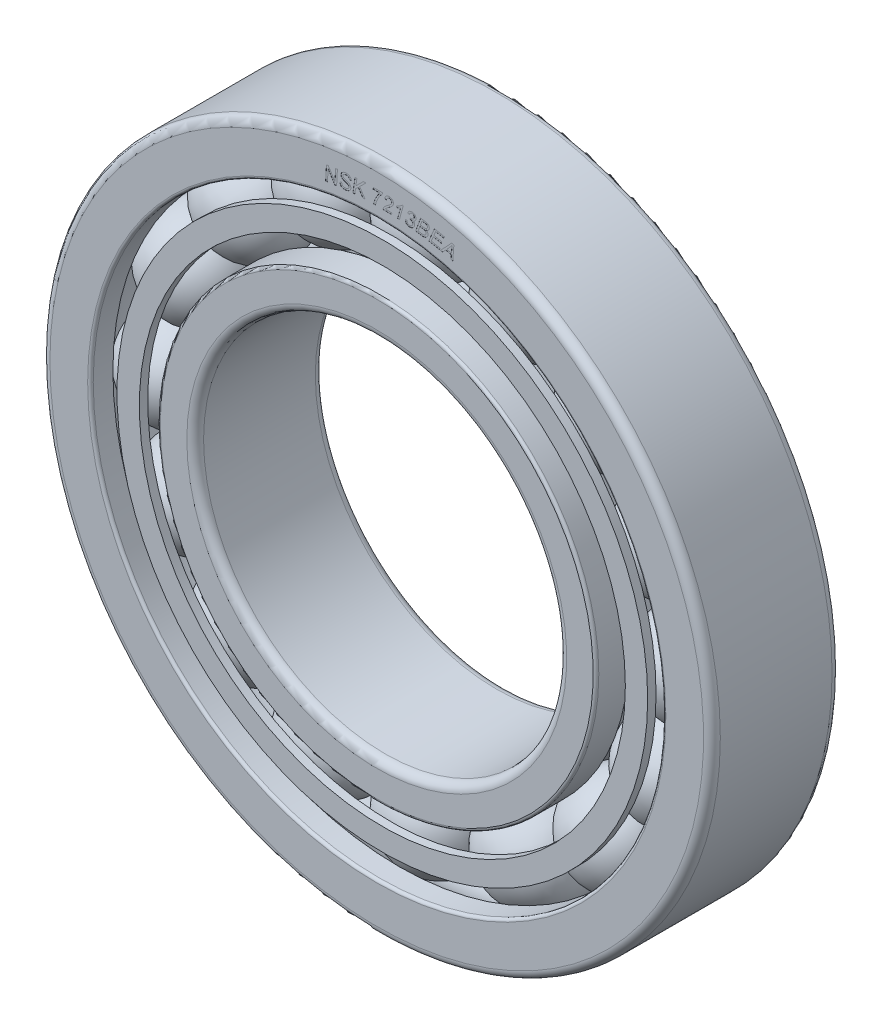
from build123d import *

# Parameters (mm, degrees)
FILLET_1_R               = 1.5
FILLET_2_R               = 1.5
FILLET_3_R               = 0.5
FILLET_4_R               = 0.5
PATTERN_CIRCULAR_1_COUNT = 16
CUT_EXTRUDE_1_DEPTH      = 0.02
SKETCH_5_R               = 47.5
SKETCH_5_R_2             = 43.5
EXTRUDE_1_DEPTH          = 1.5
SKETCH_7_R               = 50.5
SKETCH_7_R_2             = 46.5
EXTRUDE_3_DEPTH          = 1.5


with BuildPart() as part:
    # Эскиз1 → Повернуть1 (revolve)
    with BuildSketch(Plane(origin=(0, 0, 0), x_dir=(0, 0, -1), z_dir=(1, 0, 0)), mode=Mode.PRIVATE) as revolve_1_sk:
        with BuildLine():
            Line((0, 39.25), (5.843145751, 39.25))
            ThreePointArc((5.843145751, 39.25), (12.854248689, 37.352471664), (18.983314774, 41.25))
            Line((18.983314774, 41.25), (23, 41.25))
            Line((23, 41.25), (23, 32.5))
            Line((23, 32.5), (0, 32.5))
            Line((0, 32.5), (0, 39.25))
        make_face()
        with BuildLine():
            Line((0, 51.25), (4.016685226, 51.25))
            ThreePointArc((4.016685226, 51.25), (7.643281753, 54.381772523), (12.363100848, 55.208518679))
            ThreePointArc((12.363100848, 55.208518679), (17.715333377, 55.150242481), (23, 56))
            Line((23, 56), (23, 60))
            Line((23, 60), (0, 60))
            Line((0, 60), (0, 51.25))
        make_face()
    revolve(revolve_1_sk.sketch.rotate(Axis((0, 0, 0), (0, 0, -1)), 90), axis=Axis((0, 0, 0), (0, 0, -1)))

    # Скругление1
    fillet_1_edges = [part.edges().sort_by_distance(p)[0] for p in [
        (-60, 0, 0),
        (-60, 0, -23),
    ]]
    fillet(fillet_1_edges, radius=FILLET_1_R)

    # Скругление2
    fillet_2_edges = [part.edges().sort_by_distance(p)[0] for p in [
        (-32.5, 0, -23),
        (-32.5, 0, 0),
    ]]
    fillet(fillet_2_edges, radius=FILLET_2_R)

    # Скругление3
    fillet_3_edges = [part.edges().sort_by_distance(p)[0] for p in [
        (-51.25, 0, 0),
        (-56, 0, -23),
    ]]
    fillet(fillet_3_edges, radius=FILLET_3_R)

    # Скругление4
    fillet_4_edges = [part.edges().sort_by_distance(p)[0] for p in [
        (-39.25, 0, 0),
        (-41.25, 0, -23),
    ]]
    fillet(fillet_4_edges, radius=FILLET_4_R)

    # Эскиз4 → Вырез-Вытянуть1 (cut)
    # profile 1 of 10: a face of its own
    with BuildSketch(Plane.XY):
        Polygon((11.410117402, 52.014880917), (13.416101887, 54.147429184), (13.80608297, 54.052763591), (13.611606916, 51.478271063), (13.291081567, 51.556473074), (13.344588206, 52.298363207), (12.343396667, 52.542230006), (11.773345165, 51.926389167), align=None)
        with BuildLine():
            Line((12.547647973, 52.762430406), (13.366196657, 52.562809482))
            Line((13.366196657, 52.562809482), (13.421246757, 53.207976075))
            add(Edge.make_bspline(
                [(13.421246757, 53.207976075), (13.42410006, 53.23919417), (13.429683917, 53.300287365), (13.438923002, 53.389816642), (13.448805368, 53.475021092), (13.45848276, 53.556174252), (13.468686135, 53.633023962), (13.479542378, 53.705910425), (13.49080921, 53.77449605), (13.498715874, 53.81885169), (13.502535689, 53.840280495)],
                knots=[0, 0, 0, 0, 1.179734743, 2.308717599, 3.387070739, 4.407736344, 5.384398534, 6.304445204, 7.180854736, 8, 8, 8, 8], degree=3))
            add(Edge.make_bspline(
                [(13.502535689, 53.840280495), (13.477941276, 53.806800128), (13.426196333, 53.736359754), (13.338850589, 53.629630787), (13.241009589, 53.514148377), (13.169767136, 53.436336693), (13.132619597, 53.395763799)],
                knots=[0, 0, 0, 0, 0.861401509, 1.812329149, 2.859295496, 4, 4, 4, 4], degree=3))
            Line((13.132619597, 53.395763799), (12.547647973, 52.762430406))
        make_face(mode=Mode.SUBTRACT)
    # profile 2 of 10: a face of its own
    with BuildSketch(Plane.XY):
        Polygon((9.310361134, 52.426513374), (10.328016253, 54.820935482), (12.130778407, 54.464396049), (12.015018851, 54.191717983), (10.546158706, 54.482403091), (10.228720279, 53.737426036), (11.660537366, 53.453943746), (11.544263323, 53.18126568), (10.112446236, 53.464747971), (9.760022698, 52.631279167), (11.332809201, 52.320014583), (11.217049644, 52.048879978), align=None)
    # profile 3 of 10: a face of its own
    with BuildSketch(Plane.XY):
        with BuildLine():
            Line((6.964164628, 52.790516231), (7.855770454, 55.23638703))
            Line((7.855770454, 55.23638703), (8.636761592, 55.123714396))
            add(Edge.make_bspline(
                [(8.636761592, 55.123714396), (8.670065128, 55.118764215), (8.731986972, 55.109560258), (8.817552225, 55.093964672), (8.889237755, 55.079441519), (8.931624179, 55.067021392), (8.950598611, 55.061461479)],
                knots=[0, 0, 0, 0, 1.261518642, 2.34556357, 3.259385699, 4, 4, 4, 4], degree=3))
            add(Edge.make_bspline(
                [(8.950598611, 55.061461479), (8.977008574, 55.052126405), (9.028092726, 55.034069798), (9.099815546, 55.000519802), (9.163743986, 54.961755353), (9.221095654, 54.918988807), (9.271099005, 54.87088899), (9.313169104, 54.816832764), (9.347443156, 54.757069029), (9.37339691, 54.692028934), (9.392062364, 54.623334956), (9.401582773, 54.55176203), (9.403463525, 54.478016282), (9.397933322, 54.428609062), (9.395115307, 54.403432713)],
                knots=[0, 0, 0, 0, 1.1523805, 2.22902166, 3.251848478, 4.224446017, 5.167819423, 6.098219032, 7.034063993, 7.993459871, 8.972769547, 9.95596292, 10.958423637, 12, 12, 12, 12], degree=3))
            add(Edge.make_bspline(
                [(9.395115307, 54.403432713), (9.392257529, 54.386410124), (9.386616906, 54.352811283), (9.374271534, 54.303721251), (9.358170067, 54.256864096), (9.339220829, 54.211829731), (9.316484574, 54.16896736), (9.29012413, 54.128320678), (9.260691211, 54.08965193), (9.228318596, 54.05287543), (9.192065981, 54.018895603), (9.152668226, 53.98746703), (9.109388909, 53.959598407), (9.062935535, 53.93437743), (9.012977442, 53.911643468), (8.959418055, 53.892301957), (8.902577767, 53.875583234), (8.863202902, 53.867403622), (8.843070846, 53.863221451)],
                knots=[0, 0, 0, 0, 0.997521362, 1.96888742, 2.921919833, 3.85914699, 4.790430785, 5.722611136, 6.656476787, 7.597471286, 8.551225263, 9.525066915, 10.50669842, 11.522572825, 12.578482913, 13.676148185, 14.81183295, 16, 16, 16, 16], degree=3))
            add(Edge.make_bspline(
                [(8.843070846, 53.863221451), (8.858743221, 53.85494258), (8.889446908, 53.838723476), (8.933379774, 53.812822642), (8.973284485, 53.7841752), (9.009563179, 53.753911227), (9.042994198, 53.722498764), (9.072257845, 53.688938973), (9.098174657, 53.653886006), (9.127470742, 53.605241223), (9.156527311, 53.541091318), (9.177805208, 53.459383441), (9.18537746, 53.37354724), (9.179477045, 53.315949082), (9.176458367, 53.286481618)],
                knots=[0, 0, 0, 0, 0.889481206, 1.742579099, 2.556943976, 3.35142084, 4.112326028, 4.856350185, 5.582744514, 6.297109402, 7.70310764, 9.099591495, 10.516138607, 12, 12, 12, 12], degree=3))
            add(Edge.make_bspline(
                [(9.176458367, 53.286481618), (9.173688735, 53.269264072), (9.16815538, 53.234865707), (9.15417037, 53.18453984), (9.138116166, 53.134759819), (9.117061676, 53.086595715), (9.093790603, 53.038912425), (9.065403225, 52.993074631), (9.034335898, 52.947795398), (8.987628452, 52.889829346), (8.923555779, 52.822797404), (8.837333491, 52.753315183), (8.742289822, 52.697230034), (8.640297703, 52.652708608), (8.532114139, 52.621895751), (8.419598348, 52.605218098), (8.303239769, 52.600785757), (8.225286817, 52.609910899), (8.185556567, 52.614561706)],
                knots=[0, 0, 0, 0, 0.629242828, 1.257143335, 1.883821055, 2.516467848, 3.153464442, 3.798151294, 4.461254772, 5.135371534, 6.484372885, 7.801657357, 9.120760229, 10.457624248, 11.810174675, 13.169485138, 14.557372589, 16, 16, 16, 16], degree=3))
            Line((8.185556567, 52.614561706), (6.964164628, 52.790516231))
        make_face()
        with BuildLine():
            Line((7.812039066, 54.14361682), (8.32343906, 54.070045191))
            add(Edge.make_bspline(
                [(8.32343906, 54.070045191), (8.35290883, 54.06622239), (8.409849462, 54.058836085), (8.492580867, 54.051745208), (8.569541253, 54.050459764), (8.640751848, 54.052386448), (8.706073193, 54.060301199), (8.765606496, 54.071712446), (8.819127314, 54.088193638), (8.867084104, 54.109287789), (8.909446744, 54.135375622), (8.947700581, 54.164932396), (8.981133979, 54.198835292), (9.009664483, 54.237089502), (9.034229845, 54.278813094), (9.052811415, 54.325121641), (9.068325032, 54.37493431), (9.07415467, 54.410024022), (9.077162392, 54.428128085)],
                knots=[0, 0, 0, 0, 1.502219794, 2.902545341, 4.194556461, 5.391726754, 6.500401025, 7.517133001, 8.452189463, 9.325398051, 10.158027216, 10.960970728, 11.764054635, 12.556445039, 13.368324901, 14.203927591, 15.073340726, 16, 16, 16, 16], degree=3))
            add(Edge.make_bspline(
                [(9.077162392, 54.428128085), (9.078933239, 54.445421163), (9.082383467, 54.479114122), (9.080782162, 54.528974378), (9.070507367, 54.57583933), (9.054624828, 54.619648415), (9.033221067, 54.659900451), (9.005842896, 54.695425146), (8.973917651, 54.72645843), (8.942664231, 54.748481998), (8.913699128, 54.763896248), (8.886918475, 54.775422542), (8.855303178, 54.785757237), (8.818956357, 54.796207478), (8.778045589, 54.805742164), (8.732205618, 54.814977097), (8.681846908, 54.824361635), (8.646387485, 54.829393311), (8.628015315, 54.832000314)],
                knots=[0, 0, 0, 0, 1.20025396, 2.338514207, 3.428208103, 4.500047067, 5.549524654, 6.563637773, 7.585745927, 8.614491883, 9.192188196, 9.850181168, 10.625658458, 11.488103848, 12.462193969, 13.52627969, 14.718320672, 16, 16, 16, 16], degree=3))
            Line((8.628015315, 54.832000314), (8.090890974, 54.909687838))
            Line((8.090890974, 54.909687838), (7.812039066, 54.14361682))
        make_face(mode=Mode.SUBTRACT)
        with BuildLine():
            Line((7.402507481, 53.018948422), (7.977189366, 52.936116029))
            add(Edge.make_bspline(
                [(7.977189366, 52.936116029), (7.995526116, 52.93344062), (8.030618862, 52.928320442), (8.080971047, 52.922621003), (8.126487688, 52.916413149), (8.167531144, 52.912621899), (8.204029633, 52.909110083), (8.235802366, 52.908028311), (8.262893799, 52.906400713), (8.279363735, 52.907020682), (8.286910489, 52.907304761)],
                knots=[0, 0, 0, 0, 1.428150576, 2.733184842, 3.905416696, 4.968126846, 5.909946473, 6.730418274, 7.418259948, 8, 8, 8, 8], degree=3))
            add(Edge.make_bspline(
                [(8.286910489, 52.907304761), (8.313196169, 52.908501545), (8.363608084, 52.910796794), (8.435603605, 52.922359047), (8.500864143, 52.93907836), (8.55992623, 52.961767484), (8.613093712, 52.991020711), (8.661385677, 53.026250258), (8.704739152, 53.067781755), (8.743285469, 53.114551912), (8.775976491, 53.165507721), (8.801867371, 53.219630404), (8.821485219, 53.275846818), (8.828327767, 53.314823128), (8.831752134, 53.334328902)],
                knots=[0, 0, 0, 0, 1.246884701, 2.391334223, 3.450554169, 4.436701339, 5.382978919, 6.319880056, 7.263217791, 8.222199516, 9.187710378, 10.126127908, 11.062216941, 12, 12, 12, 12], degree=3))
            add(Edge.make_bspline(
                [(8.831752134, 53.334328902), (8.833598712, 53.348712184), (8.837194066, 53.37671694), (8.837410722, 53.418073352), (8.834730905, 53.457257979), (8.827267801, 53.494118301), (8.816651809, 53.528972963), (8.80143872, 53.561464992), (8.783040279, 53.592165803), (8.75970931, 53.620413254), (8.731765008, 53.64729265), (8.696392433, 53.670694785), (8.655121943, 53.692869345), (8.606968679, 53.712772509), (8.552157782, 53.730473734), (8.490962165, 53.747124604), (8.422800129, 53.760636369), (8.375086, 53.768207319), (8.35019238, 53.772157267)],
                knots=[0, 0, 0, 0, 0.928863361, 1.808529546, 2.646747168, 3.442421359, 4.214421614, 4.976968448, 5.736894975, 6.50276378, 7.319431662, 8.213005398, 9.211612466, 10.320415641, 11.547771308, 12.902653025, 14.384038861, 16, 16, 16, 16], degree=3))
            Line((8.35019238, 53.772157267), (7.710170657, 53.864764912))
            Line((7.710170657, 53.864764912), (7.402507481, 53.018948422))
        make_face(mode=Mode.SUBTRACT)
    # profile 4 of 10: a face of its own
    with BuildSketch(Plane.XY):
        with BuildLine():
            Line((5.113077534, 53.668024552), (5.419711736, 53.672140447))
            add(Edge.make_bspline(
                [(5.419711736, 53.672140447), (5.420561218, 53.650523142), (5.42220879, 53.608596298), (5.427540586, 53.547882002), (5.436860438, 53.491513821), (5.449227728, 53.439651968), (5.463750145, 53.391874776), (5.482518693, 53.348897296), (5.504110663, 53.310036384), (5.528849571, 53.275221694), (5.556918718, 53.244933186), (5.587091097, 53.217702992), (5.620099412, 53.19384601), (5.656278879, 53.17408349), (5.694732486, 53.156783268), (5.735898166, 53.142991054), (5.779809371, 53.132542547), (5.810159359, 53.128729487), (5.825641913, 53.126784316)],
                knots=[0, 0, 0, 0, 1.368518898, 2.654247442, 3.852800615, 4.979057231, 6.02557499, 7.007091832, 7.939661417, 8.833829618, 9.701543587, 10.546649616, 11.401724475, 12.271064648, 13.150098862, 14.066114148, 15.01345952, 16, 16, 16, 16], degree=3))
            add(Edge.make_bspline(
                [(5.825641913, 53.126784316), (5.844659154, 53.125014132), (5.882138905, 53.1215254), (5.938044622, 53.123233069), (5.992454053, 53.130583321), (6.045411438, 53.142794793), (6.097101627, 53.160623437), (6.147270725, 53.183669558), (6.196179522, 53.21233516), (6.242712666, 53.246096213), (6.286822329, 53.282858068), (6.325217238, 53.323484453), (6.35984671, 53.365120347), (6.38842973, 53.409514894), (6.41267932, 53.4556889), (6.430746324, 53.50421691), (6.445483098, 53.554482261), (6.450000119, 53.589215843), (6.452286977, 53.606800609)],
                knots=[0, 0, 0, 0, 1.048299956, 2.066021117, 3.063843733, 4.060064421, 5.046079128, 6.061880388, 7.08776429, 8.154315161, 9.216906954, 10.236196254, 11.220409526, 12.18711235, 13.130824451, 14.078992142, 15.027440536, 16, 16, 16, 16], degree=3))
            add(Edge.make_bspline(
                [(6.452286977, 53.606800609), (6.453611409, 53.622051038), (6.456198232, 53.651837521), (6.455022448, 53.696131515), (6.449956614, 53.738868431), (6.440765746, 53.780118998), (6.427211493, 53.819580117), (6.409586635, 53.857605297), (6.387390252, 53.893786277), (6.361781912, 53.928603426), (6.331828556, 53.96004496), (6.299421884, 53.989432564), (6.263221589, 54.014364714), (6.22426182, 54.036376931), (6.18192038, 54.054290556), (6.136514116, 54.068408636), (6.088286286, 54.080183005), (6.054817362, 54.084564377), (6.037610523, 54.086816901)],
                knots=[0, 0, 0, 0, 1.029695649, 2.011157245, 2.976189254, 3.922749042, 4.849966026, 5.7795512, 6.737723937, 7.702755946, 8.682790949, 9.655798565, 10.642135673, 11.634399209, 12.663577097, 13.729578544, 14.832744694, 16, 16, 16, 16], degree=3))
            add(Edge.make_bspline(
                [(6.037610523, 54.086816901), (6.03246479, 54.087145558), (6.020112673, 54.087934484), (5.9983677, 54.089761769), (5.970039808, 54.090444646), (5.948946, 54.091090347), (5.937285574, 54.091447284)],
                knots=[0, 0, 0, 0, 0.615994507, 1.478669069, 2.606235819, 4, 4, 4, 4], degree=3))
            Line((5.937285574, 54.091447284), (6.01960348, 54.345089333))
            add(Edge.make_bspline(
                [(6.01960348, 54.345089333), (6.033953026, 54.341376166), (6.062099719, 54.334092773), (6.090893813, 54.330078842), (6.105008309, 54.328111265)],
                knots=[0, 0, 0, 0, 1.019625648, 2, 2, 2, 2], degree=3))
            add(Edge.make_bspline(
                [(6.105008309, 54.328111265), (6.126597815, 54.326139276), (6.168687151, 54.322294828), (6.230441419, 54.320960981), (6.288759895, 54.325221136), (6.343622689, 54.333466446), (6.395398975, 54.345344215), (6.443432777, 54.363319327), (6.488559511, 54.38464421), (6.529704731, 54.411165782), (6.566977401, 54.440779512), (6.600321132, 54.472936299), (6.629346714, 54.507576705), (6.654003043, 54.544760578), (6.674867931, 54.583932957), (6.690752607, 54.625630963), (6.702985428, 54.669519175), (6.706983267, 54.700014649), (6.709015948, 54.715519913)],
                knots=[0, 0, 0, 0, 1.290371175, 2.515614044, 3.672111614, 4.76651754, 5.816401615, 6.827292839, 7.813552476, 8.782111313, 9.733954635, 10.64363931, 11.535096621, 12.418509131, 13.295290033, 14.17117896, 15.070145496, 16, 16, 16, 16], degree=3))
            add(Edge.make_bspline(
                [(6.709015948, 54.715519913), (6.710326342, 54.729738564), (6.712912615, 54.757801352), (6.711873896, 54.799568182), (6.706300275, 54.839902749), (6.698791916, 54.879171755), (6.685112519, 54.916599272), (6.669039903, 54.953228721), (6.648168582, 54.988214403), (6.624016759, 55.021571676), (6.59726993, 55.052513189), (6.567983021, 55.08027884), (6.536634089, 55.104445683), (6.503036534, 55.125220247), (6.46732346, 55.141956909), (6.43004633, 55.156398284), (6.390187305, 55.16588317), (6.362800138, 55.169851902), (6.348875107, 55.171869807)],
                knots=[0, 0, 0, 0, 1.056959341, 2.086078723, 3.0848893, 4.071348344, 5.039401223, 6.028554957, 7.030590634, 8.049390597, 9.07576304, 10.055082359, 11.033165423, 12.002550561, 12.974013698, 13.950693782, 14.958028298, 16, 16, 16, 16], degree=3))
            add(Edge.make_bspline(
                [(6.348875107, 55.171869807), (6.335166261, 55.172966966), (6.307770993, 55.175159489), (6.26673343, 55.174147234), (6.226450851, 55.168877688), (6.186805109, 55.160062524), (6.147781765, 55.147304216), (6.109585298, 55.129966183), (6.07175743, 55.10939378), (6.035000924, 55.084680216), (5.999407059, 55.056792176), (5.967122804, 55.024310679), (5.936373811, 54.989551896), (5.90912286, 54.950283578), (5.883888258, 54.907945555), (5.862103855, 54.861688837), (5.841372397, 54.81272273), (5.830975212, 54.778060483), (5.825641913, 54.760280275)],
                knots=[0, 0, 0, 0, 0.908235866, 1.814986241, 2.706025465, 3.588449818, 4.494987781, 5.413065499, 6.356251536, 7.336745671, 8.336559827, 9.338106043, 10.358196282, 11.398784442, 12.490903383, 13.610881053, 14.77448709, 16, 16, 16, 16], degree=3))
            Line((5.825641913, 54.760280275), (5.526725015, 54.857003815))
            add(Edge.make_bspline(
                [(5.526725015, 54.857003815), (5.536335472, 54.881500066), (5.555220895, 54.929637432), (5.588773991, 54.99808116), (5.625913088, 55.061823801), (5.666995035, 55.120703864), (5.712604466, 55.174298417), (5.76142845, 55.223414559), (5.814340071, 55.267462069), (5.870882348, 55.306425668), (5.930190727, 55.340353513), (5.992005065, 55.36817559), (6.055254306, 55.390954055), (6.120501673, 55.408012207), (6.187650465, 55.419401112), (6.256833221, 55.424711995), (6.327918503, 55.425801287), (6.375650702, 55.421168374), (6.399809311, 55.418823527)],
                knots=[0, 0, 0, 0, 1.120118601, 2.201135125, 3.241914166, 4.258929712, 5.253786321, 6.234879163, 7.204462945, 8.180815521, 9.155418752, 10.109701985, 11.063649871, 12.014798608, 12.977621396, 13.959447744, 14.967219058, 16, 16, 16, 16], degree=3))
            add(Edge.make_bspline(
                [(6.399809311, 55.418823527), (6.424928285, 55.415507379), (6.474186738, 55.409004394), (6.545212009, 55.391703235), (6.612149692, 55.36971612), (6.674750452, 55.341825046), (6.732964461, 55.308306209), (6.786996379, 55.26961151), (6.835991653, 55.224917176), (6.880505746, 55.175733644), (6.920108069, 55.122945456), (6.953590863, 55.067452782), (6.98057461, 55.009827745), (7.001386029, 54.950201331), (7.015648476, 54.888428774), (7.024044895, 54.824691898), (7.025604694, 54.758973014), (7.021733606, 54.714813161), (7.019766045, 54.692368002)],
                knots=[0, 0, 0, 0, 1.136359437, 2.228407424, 3.274947664, 4.294742082, 5.29805241, 6.284903422, 7.271154013, 8.26827567, 9.258033554, 10.228176563, 11.171574053, 12.108671656, 13.057047696, 14.01168022, 14.98939534, 16, 16, 16, 16], degree=3))
            add(Edge.make_bspline(
                [(7.019766045, 54.692368002), (7.015143834, 54.660236501), (7.006103387, 54.597391433), (6.975196794, 54.50859947), (6.933485937, 54.426951546), (6.878146014, 54.353867114), (6.810556646, 54.288833512), (6.731133711, 54.231472549), (6.639032215, 54.182343478), (6.571975958, 54.157050607), (6.537177318, 54.143924949)],
                knots=[0, 0, 0, 0, 1.002220091, 1.960213137, 2.892776631, 3.828654363, 4.781654184, 5.784505993, 6.850276135, 8, 8, 8, 8], degree=3))
            add(Edge.make_bspline(
                [(6.537177318, 54.143924949), (6.559081325, 54.126616117), (6.601757917, 54.092892516), (6.656333103, 54.034863553), (6.701339248, 53.973633933), (6.736294044, 53.908716068), (6.760959927, 53.840165697), (6.776846595, 53.768276642), (6.781842483, 53.692686166), (6.777906116, 53.641594729), (6.775899247, 53.615546886)],
                knots=[0, 0, 0, 0, 1.097875357, 2.139041469, 3.124884337, 4.08243844, 5.03076001, 5.984258987, 6.972318896, 8, 8, 8, 8], degree=3))
            add(Edge.make_bspline(
                [(6.775899247, 53.615546886), (6.772029058, 53.587823102), (6.764376996, 53.53300817), (6.742777918, 53.453637503), (6.714507404, 53.377851564), (6.678156831, 53.305706867), (6.633797709, 53.237398156), (6.582082302, 53.172781237), (6.522711085, 53.112073133), (6.456690386, 53.055870237), (6.385881785, 53.005230755), (6.311794442, 52.962186139), (6.235672765, 52.927140767), (6.157164663, 52.899926155), (6.076400057, 52.881507076), (5.993332822, 52.871383442), (5.908191105, 52.868334002), (5.851001445, 52.873233558), (5.822040505, 52.875714701)],
                knots=[0, 0, 0, 0, 1.002765114, 1.982647835, 2.941942652, 3.898869908, 4.872715141, 5.856986452, 6.861409093, 7.912476156, 8.961761214, 9.978399029, 10.979862573, 11.961826545, 12.952224482, 13.943671621, 14.958671857, 16, 16, 16, 16], degree=3))
            add(Edge.make_bspline(
                [(5.822040505, 52.875714701), (5.794180231, 52.879367925), (5.739785016, 52.886500586), (5.661145668, 52.904761008), (5.587369138, 52.928463106), (5.517999223, 52.957210014), (5.453430541, 52.991670285), (5.393827407, 53.032106359), (5.339178302, 53.078137779), (5.289225649, 53.128993797), (5.244892501, 53.184403106), (5.207458913, 53.244092761), (5.175124009, 53.306329185), (5.149963562, 53.372325298), (5.130636472, 53.441524618), (5.118878564, 53.514345175), (5.111545308, 53.59019049), (5.112560682, 53.641769478), (5.113077534, 53.668024552)],
                knots=[0, 0, 0, 0, 1.138289366, 2.222429499, 3.26652677, 4.275970636, 5.26173364, 6.227569183, 7.189595697, 8.152952069, 9.112539919, 10.059304643, 11.004307278, 11.950459474, 12.916695094, 13.910827577, 14.936555761, 16, 16, 16, 16], degree=3))
        make_face()
    # profile 5 of 10: a face of its own
    with BuildSketch(Plane.XY):
        with BuildLine():
            Line((3.7334604, 53.116639928), (4.260809489, 55.0130387))
            add(Edge.make_bspline(
                [(4.260809489, 55.0130387), (4.237211218, 54.997378405), (4.188920008, 54.965331369), (4.109962257, 54.923687975), (4.025354691, 54.884095639), (3.934097534, 54.84751727), (3.836677698, 54.813535795), (3.732263773, 54.783548374), (3.621838812, 54.755507105), (3.545573522, 54.740039125), (3.50657167, 54.732128844)],
                knots=[0, 0, 0, 0, 0.838411649, 1.715715178, 2.640638597, 3.60467088, 4.626384728, 5.695356246, 6.821411767, 8, 8, 8, 8], degree=3))
            Line((3.50657167, 54.732128844), (3.583744708, 55.0130387))
            add(Edge.make_bspline(
                [(3.583744708, 55.0130387), (3.624023048, 55.02704425), (3.705189595, 55.055267412), (3.825355741, 55.105383309), (3.944685734, 55.163441773), (4.061579434, 55.226275527), (4.170583155, 55.291464548), (4.268144203, 55.353494645), (4.351403095, 55.41145576), (4.399941657, 55.451437967), (4.422358381, 55.469903082)],
                knots=[0, 0, 0, 0, 1.066132409, 2.148407456, 3.253132279, 4.383208523, 5.465755388, 6.428090278, 7.274039752, 8, 8, 8, 8], degree=3))
            add(Edge.make_bspline(
                [(4.422358381, 55.469903082), (4.447408546, 55.493457196), (4.499711271, 55.542636286), (4.542888213, 55.600012428), (4.565385744, 55.629908513)],
                knots=[0, 0, 0, 0, 0.957891411, 2, 2, 2, 2], degree=3))
            Line((4.565385744, 55.629908513), (4.747514112, 55.618075314))
            Line((4.747514112, 55.618075314), (4.049355367, 53.096574938))
            Line((4.049355367, 53.096574938), (3.7334604, 53.116639928))
        make_face()
    # profile 6 of 10: a face of its own
    with BuildSketch(Plane.XY):
        with BuildLine():
            add(Edge.make_bspline(
                [(1.110849669, 53.233605524), (1.120863094, 53.269754246), (1.140218746, 53.33962865), (1.175537123, 53.438686257), (1.215856077, 53.527933683), (1.260012232, 53.609508325), (1.31098104, 53.684439106), (1.367916755, 53.756129875), (1.431190031, 53.825925208), (1.49108972, 53.881926662), (1.545317819, 53.929574697), (1.59548954, 53.970401118), (1.653487355, 54.017442696), (1.720632426, 54.069258831), (1.796175526, 54.126770477), (1.880078689, 54.189998481), (1.972073655, 54.259134194), (2.036698061, 54.306387078), (2.070367768, 54.331006116)],
                knots=[0, 0, 0, 0, 1.202700078, 2.324783473, 3.36848823, 4.340727197, 5.295622279, 6.270517662, 7.274952979, 8.313660986, 8.898299247, 9.589812029, 10.387759059, 11.293159435, 12.309554252, 13.432621145, 14.662380076, 16, 16, 16, 16], degree=3))
            add(Edge.make_bspline(
                [(2.070367768, 54.331006116), (2.090822655, 54.345862665), (2.130204553, 54.374466055), (2.186153914, 54.416665802), (2.23716017, 54.455898472), (2.283436509, 54.491731722), (2.324623332, 54.524635974), (2.360657028, 54.55446209), (2.391846195, 54.581243522), (2.410495046, 54.598653749), (2.419189897, 54.606771103)],
                knots=[0, 0, 0, 0, 1.363740725, 2.625617026, 3.780249737, 4.835058242, 5.78285203, 6.623854171, 7.358385035, 8, 8, 8, 8], degree=3))
            add(Edge.make_bspline(
                [(2.419189897, 54.606771103), (2.440560379, 54.628115652), (2.481900705, 54.669405812), (2.537296721, 54.733518921), (2.58324669, 54.798216218), (2.607880201, 54.842856263), (2.619839794, 54.864529048)],
                knots=[0, 0, 0, 0, 1.104403278, 2.136423082, 3.0952316, 4, 4, 4, 4], degree=3))
            add(Edge.make_bspline(
                [(2.619839794, 54.864529048), (2.626535302, 54.879142788), (2.640039936, 54.908618255), (2.654006958, 54.9557071), (2.664279942, 55.004747522), (2.66654166, 55.03837401), (2.667687077, 55.055403694)],
                knots=[0, 0, 0, 0, 0.972384877, 1.961270675, 2.967512838, 4, 4, 4, 4], degree=3))
            add(Edge.make_bspline(
                [(2.667687077, 55.055403694), (2.667983583, 55.069816462), (2.668567395, 55.098194876), (2.664323528, 55.140112323), (2.655975515, 55.180375055), (2.644223758, 55.219254952), (2.628189688, 55.25654738), (2.607724661, 55.292100526), (2.584347312, 55.326793358), (2.556267758, 55.358929667), (2.526062422, 55.388981092), (2.493270738, 55.415460123), (2.458787617, 55.438333928), (2.421901362, 55.456854006), (2.383278926, 55.471772976), (2.342805724, 55.483105243), (2.300464166, 55.49113177), (2.271396399, 55.492864997), (2.256612031, 55.493746546)],
                knots=[0, 0, 0, 0, 1.032712451, 2.033387493, 3.01230198, 3.976750105, 4.940492736, 5.914919251, 6.914082699, 7.934204665, 8.968744991, 9.965257631, 10.950712394, 11.92939525, 12.917989265, 13.914350217, 14.939202523, 16, 16, 16, 16], degree=3))
            add(Edge.make_bspline(
                [(2.256612031, 55.493746546), (2.241852641, 55.4940622), (2.212782709, 55.494683908), (2.169761354, 55.490147891), (2.127978778, 55.482756298), (2.087392371, 55.470547624), (2.047912694, 55.454937298), (2.010142119, 55.434355011), (1.973348075, 55.410653996), (1.937899013, 55.382923061), (1.90402658, 55.3507692), (1.872773028, 55.313468813), (1.843428486, 55.271598024), (1.81610177, 55.225220723), (1.791420745, 55.173843134), (1.768981477, 55.117741267), (1.748214258, 55.05680946), (1.736733398, 55.014146541), (1.730806403, 54.992121803)],
                knots=[0, 0, 0, 0, 0.891257531, 1.755410997, 2.609123593, 3.451883803, 4.312113384, 5.169842291, 6.046581179, 6.954611879, 7.88553672, 8.863498142, 9.889951607, 10.972375156, 12.112591228, 13.33077172, 14.622010552, 16, 16, 16, 16], degree=3))
            Line((1.730806403, 54.992121803), (1.425201175, 55.050773312))
            add(Edge.make_bspline(
                [(1.425201175, 55.050773312), (1.430606743, 55.078141001), (1.441209282, 55.131820282), (1.464018264, 55.209061132), (1.491807416, 55.281802525), (1.52530616, 55.349497898), (1.563400719, 55.413020446), (1.607467874, 55.47106367), (1.655978088, 55.525172023), (1.709897923, 55.573810085), (1.768153204, 55.616887867), (1.829323239, 55.654832127), (1.894123948, 55.685703042), (1.961811994, 55.710540584), (2.032471338, 55.728953073), (2.106118625, 55.741521318), (2.182957689, 55.746990596), (2.235170632, 55.746231605), (2.261756901, 55.745845135)],
                knots=[0, 0, 0, 0, 1.116229553, 2.189384642, 3.219517052, 4.229621657, 5.209193556, 6.179920926, 7.142310277, 8.114396123, 9.081012233, 10.039426678, 10.991303179, 11.949102743, 12.921552144, 13.91022317, 14.93590812, 16, 16, 16, 16], degree=3))
            add(Edge.make_bspline(
                [(2.261756901, 55.745845135), (2.297188913, 55.743240132), (2.366566374, 55.738139419), (2.467470235, 55.71654946), (2.562649088, 55.684081912), (2.651504609, 55.640959827), (2.732439659, 55.588650868), (2.802248619, 55.525927063), (2.861367841, 55.455034618), (2.906903153, 55.375370856), (2.942206758, 55.292164044), (2.966805558, 55.206867469), (2.98015758, 55.120495257), (2.980039522, 55.062648702), (2.979980635, 55.033795244)],
                knots=[0, 0, 0, 0, 1.128828806, 2.210297158, 3.271047296, 4.319952983, 5.344076798, 6.325149161, 7.293740772, 8.266591968, 9.231984258, 10.162465089, 11.083450395, 12, 12, 12, 12], degree=3))
            add(Edge.make_bspline(
                [(2.979980635, 55.033795244), (2.978428487, 55.012838638), (2.975320211, 54.970871726), (2.964600523, 54.908395265), (2.947090285, 54.846998347), (2.925309468, 54.785951836), (2.896543208, 54.726375593), (2.863086201, 54.667433491), (2.823775685, 54.609510602), (2.794006677, 54.572608981), (2.778816251, 54.553778951)],
                knots=[0, 0, 0, 0, 0.951069821, 1.904576784, 2.863379649, 3.838485029, 4.835234883, 5.854116166, 6.905005866, 8, 8, 8, 8], degree=3))
            add(Edge.make_bspline(
                [(2.778816251, 54.553778951), (2.773338122, 54.54759795), (2.761502099, 54.534243304), (2.742206694, 54.51288159), (2.718065865, 54.490705452), (2.691747622, 54.46537681), (2.661399071, 54.43844211), (2.62783238, 54.409399164), (2.590568033, 54.37840622), (2.549767206, 54.345497058), (2.505698577, 54.310162482), (2.458486816, 54.272397797), (2.407164011, 54.233452155), (2.353070101, 54.191765906), (2.294993064, 54.148580166), (2.234137965, 54.102635586), (2.16894952, 54.055450493), (2.124547893, 54.023016793), (2.10175147, 54.006364872)],
                knots=[0, 0, 0, 0, 0.454717768, 0.982461328, 1.583403455, 2.257924967, 2.993320043, 3.816599997, 4.701397922, 5.661229844, 6.702134953, 7.810868785, 8.989125278, 10.248547441, 11.570226374, 12.973095425, 14.445944406, 16, 16, 16, 16], degree=3))
            add(Edge.make_bspline(
                [(2.10175147, 54.006364872), (2.082361199, 53.992146607), (2.044687921, 53.964521998), (1.989940024, 53.92397862), (1.939472317, 53.884836595), (1.891993865, 53.848604301), (1.849797383, 53.812571367), (1.809814179, 53.780141237), (1.774480767, 53.748701638), (1.733210788, 53.710216655), (1.687608867, 53.664131258), (1.638635392, 53.609849921), (1.596813837, 53.556951009), (1.573615141, 53.520535673), (1.562569182, 53.503196668)],
                knots=[0, 0, 0, 0, 1.166534815, 2.266455786, 3.304868386, 4.265181266, 5.16321159, 5.996259981, 6.762521778, 7.457137211, 8.733803487, 9.906345992, 11.003115682, 12, 12, 12, 12], degree=3))
            Line((1.562569182, 53.503196668), (2.701643214, 53.455349385))
            Line((2.701643214, 53.455349385), (2.628586072, 53.169809147))
            Line((2.628586072, 53.169809147), (1.110849669, 53.233605524))
        make_face()
    # profile 7 of 10: a face of its own
    with BuildSketch(Plane.XY):
        with BuildLine():
            add(Edge.make_bspline(
                [(-0.558029174, 53.241749748), (-0.554412724, 53.263729747), (-0.546957167, 53.309043011), (-0.532387476, 53.378341321), (-0.514811488, 53.451066302), (-0.494206795, 53.526839564), (-0.470961759, 53.605941713), (-0.444768675, 53.688127234), (-0.415246044, 53.773593849), (-0.394321124, 53.831548447), (-0.38361811, 53.861191995)],
                knots=[0, 0, 0, 0, 0.829353319, 1.709768305, 2.635957467, 3.614948424, 4.633340765, 5.70569938, 6.826474284, 8, 8, 8, 8], degree=3))
            add(Edge.make_bspline(
                [(-0.38361811, 53.861191995), (-0.355735272, 53.934216909), (-0.299510155, 54.081470009), (-0.200344878, 54.298805406), (-0.089191928, 54.515416938), (0.013112994, 54.693786415), (0.099977808, 54.834345952), (0.168257437, 54.936382984), (0.237915867, 55.034982863), (0.309499205, 55.129665897), (0.382627806, 55.220701691), (0.458377855, 55.307332994), (0.535368062, 55.390934648), (0.58857748, 55.444103632), (0.615000994, 55.470507068)],
                knots=[0, 0, 0, 0, 1.473953433, 2.972193993, 4.502669018, 6.064485725, 6.848934555, 7.618627882, 8.379655031, 9.125526554, 9.856972894, 10.581449156, 11.295555173, 12, 12, 12, 12], degree=3))
            Line((0.615000994, 55.470507068), (-0.654238228, 55.463818738))
            Line((-0.654238228, 55.463818738), (-0.595072232, 55.752445898))
            Line((-0.595072232, 55.752445898), (1.030191936, 55.760677689))
            Line((1.030191936, 55.760677689), (0.972569401, 55.472565016))
            add(Edge.make_bspline(
                [(0.972569401, 55.472565016), (0.938448329, 55.441359719), (0.869774333, 55.378554177), (0.77204075, 55.277079711), (0.677287169, 55.169442155), (0.585611928, 55.055226255), (0.497849368, 54.934038391), (0.412740191, 54.806902493), (0.331299745, 54.672946168), (0.280565413, 54.580135654), (0.254860153, 54.533111907)],
                knots=[0, 0, 0, 0, 0.933587849, 1.878991596, 2.84336905, 3.828852324, 4.835398066, 5.864149695, 6.917841515, 8, 8, 8, 8], degree=3))
            add(Edge.make_bspline(
                [(0.254860153, 54.533111907), (0.226016032, 54.478252407), (0.168967888, 54.369750827), (0.090868576, 54.20544631), (0.019989037, 54.042305817), (-0.044811805, 53.880559903), (-0.101632851, 53.719807889), (-0.15192587, 53.560317023), (-0.194742031, 53.402025646), (-0.218179919, 53.296208881), (-0.229786522, 53.243807696)],
                knots=[0, 0, 0, 0, 1.076210614, 2.128538385, 3.158152719, 4.164629244, 5.153634817, 6.118124782, 7.068082514, 8, 8, 8, 8], degree=3))
            Line((-0.229786522, 53.243807696), (-0.558029174, 53.241749748))
        make_face()
    # profile 8 of 10: a face of its own
    with BuildSketch(Plane.XY):
        Polygon((-4.268311776, 53.075496098), (-3.896852222, 55.654619008), (-3.556776371, 55.676227459), (-3.734788844, 54.434256043), (-2.429535538, 55.747226653), (-1.950548219, 55.777066894), (-3.068013801, 54.666289642), (-2.106437755, 53.211835131), (-2.486643586, 53.187654246), (-3.302619834, 54.431683609), (-3.806302525, 53.934689248), (-3.927721437, 53.097104548), align=None)
    # profile 9 of 10: a face of its own
    with BuildSketch(Plane.XY):
        with BuildLine():
            Line((-6.609009989, 53.661206565), (-6.278194902, 53.722430508))
            Line((-6.278194902, 53.722430508), (-6.274079007, 53.633424272))
            add(Edge.make_bspline(
                [(-6.274079007, 53.633424272), (-6.271109879, 53.609465897), (-6.265245331, 53.562143913), (-6.245512953, 53.493846182), (-6.218945965, 53.428900812), (-6.183442989, 53.36838739), (-6.138416799, 53.313455443), (-6.082241471, 53.266753217), (-6.016045327, 53.227895008), (-5.939888898, 53.198045473), (-5.85562356, 53.176041986), (-5.763956814, 53.163498905), (-5.665713689, 53.159928387), (-5.598368168, 53.164448975), (-5.563572576, 53.166784639)],
                knots=[0, 0, 0, 0, 0.900836824, 1.779310477, 2.646871574, 3.517291588, 4.391101762, 5.287070707, 6.232219634, 7.247254626, 8.333709868, 9.479205135, 10.697574099, 12, 12, 12, 12], degree=3))
            add(Edge.make_bspline(
                [(-5.563572576, 53.166784639), (-5.538838405, 53.169400746), (-5.490882721, 53.174472966), (-5.421555238, 53.186797966), (-5.357263583, 53.203212062), (-5.29783403, 53.223148725), (-5.243445349, 53.24693783), (-5.193614575, 53.274158575), (-5.148754569, 53.305562125), (-5.109021497, 53.340573412), (-5.074989689, 53.378284091), (-5.044825272, 53.416054889), (-5.020106487, 53.455144355), (-5.001489874, 53.495288225), (-4.986280648, 53.535692448), (-4.97805106, 53.577182598), (-4.973197411, 53.619282703), (-4.975078486, 53.647480052), (-4.976028518, 53.661721052)],
                knots=[0, 0, 0, 0, 1.395969759, 2.706566712, 3.948796917, 5.117879318, 6.221506061, 7.27723044, 8.300181788, 9.289181072, 10.243117695, 11.148296008, 12.000414111, 12.831552934, 13.629406428, 14.416794091, 15.200405859, 16, 16, 16, 16], degree=3))
            add(Edge.make_bspline(
                [(-4.976028518, 53.661721052), (-4.978918634, 53.681269257), (-4.984657661, 53.720086957), (-5.006022052, 53.775661052), (-5.037783485, 53.827521231), (-5.065993026, 53.857352253), (-5.080469362, 53.872660688)],
                knots=[0, 0, 0, 0, 0.98425914, 1.954485125, 2.95029978, 4, 4, 4, 4], degree=3))
            add(Edge.make_bspline(
                [(-5.080469362, 53.872660688), (-5.089904341, 53.880607093), (-5.110852517, 53.898250238), (-5.149816296, 53.921941805), (-5.197659876, 53.947451248), (-5.254919831, 53.974783477), (-5.322063799, 54.002753433), (-5.398658384, 54.032672319), (-5.485117917, 54.063242482), (-5.546049983, 54.083690071), (-5.577978209, 54.094404549)],
                knots=[0, 0, 0, 0, 0.540193669, 1.199374389, 1.993337854, 2.918253284, 3.979659742, 5.18193929, 6.52334436, 8, 8, 8, 8], degree=3))
            add(Edge.make_bspline(
                [(-5.577978209, 54.094404549), (-5.603021617, 54.102791822), (-5.651103774, 54.118894988), (-5.720042948, 54.142264382), (-5.782473256, 54.165210673), (-5.838942279, 54.186178398), (-5.889517677, 54.20553843), (-5.933667222, 54.2241525), (-5.971848859, 54.240929628), (-5.994917333, 54.252281118), (-6.005516837, 54.257496901)],
                knots=[0, 0, 0, 0, 1.384197928, 2.657594401, 3.814828672, 4.869965264, 5.814700581, 6.652670015, 7.380928718, 8, 8, 8, 8], degree=3))
            add(Edge.make_bspline(
                [(-6.005516837, 54.257496901), (-6.034329783, 54.273749858), (-6.089901357, 54.305096961), (-6.164676486, 54.35934438), (-6.228986829, 54.416676949), (-6.282359512, 54.478350117), (-6.32460656, 54.545466048), (-6.357286545, 54.617351153), (-6.379890893, 54.695026962), (-6.386476194, 54.749037252), (-6.389838563, 54.776614199)],
                knots=[0, 0, 0, 0, 1.172594345, 2.261584516, 3.26940021, 4.222785237, 5.144197471, 6.072511015, 7.01584935, 8, 8, 8, 8], degree=3))
            add(Edge.make_bspline(
                [(-6.389838563, 54.776614199), (-6.391300956, 54.808699754), (-6.394182264, 54.871916903), (-6.382031395, 54.965801162), (-6.355254309, 55.05564942), (-6.322197092, 55.127065823), (-6.289176264, 55.181306515), (-6.260371383, 55.220017044), (-6.229340897, 55.257564993), (-6.193247046, 55.291465784), (-6.155494841, 55.325007105), (-6.113271501, 55.354960746), (-6.068712699, 55.384216712), (-6.003302456, 55.418969657), (-5.916229843, 55.458326752), (-5.803821191, 55.493619701), (-5.684505048, 55.521264499), (-5.60178167, 55.530329733), (-5.55945668, 55.534967913)],
                knots=[0, 0, 0, 0, 1.22055395, 2.404818596, 3.581886521, 4.77610736, 5.388352723, 5.995323172, 6.611175313, 7.238843851, 7.877343758, 8.531331491, 9.206563201, 9.904499128, 11.347716291, 12.835758416, 14.381032093, 16, 16, 16, 16], degree=3))
            add(Edge.make_bspline(
                [(-5.55945668, 55.534967913), (-5.534088813, 55.536933769), (-5.484260479, 55.540795161), (-5.410592147, 55.542206112), (-5.339659654, 55.540347647), (-5.271524418, 55.534458746), (-5.205953722, 55.526161681), (-5.143343709, 55.51301746), (-5.083282479, 55.497231595), (-5.026239002, 55.47768748), (-4.972456886, 55.454963117), (-4.921503766, 55.430373547), (-4.874485644, 55.402669943), (-4.830788372, 55.372601604), (-4.790578832, 55.340060584), (-4.753376797, 55.305326971), (-4.720304223, 55.267314104), (-4.681519278, 55.214788281), (-4.640478418, 55.147658988), (-4.602791359, 55.065956457), (-4.575454917, 54.985312231), (-4.568396568, 54.93079884), (-4.564953472, 54.904206954)],
                knots=[0, 0, 0, 0, 1.160068754, 2.278642183, 3.35832045, 4.394200807, 5.396259216, 6.370182636, 7.309192946, 8.226724522, 9.117056899, 9.970456282, 10.804721317, 11.603022496, 12.387139285, 13.161642349, 13.920872752, 14.681028972, 16.137611383, 17.498755323, 18.779881198, 20, 20, 20, 20], degree=3))
            add(Edge.make_bspline(
                [(-4.564953472, 54.904206954), (-4.564381666, 54.897350217), (-4.562939831, 54.880060636), (-4.562591329, 54.862712158), (-4.562381037, 54.852243776)],
                knots=[0, 0, 0, 0, 0.793164161, 2, 2, 2, 2], degree=3))
            Line((-4.562381037, 54.852243776), (-4.888565742, 54.796679189))
            add(Edge.make_bspline(
                [(-4.888565742, 54.796679189), (-4.890305407, 54.813673877), (-4.893584064, 54.845702902), (-4.900422719, 54.890682094), (-4.910015562, 54.929428067), (-4.918563461, 54.952628937), (-4.922521878, 54.96337295)],
                knots=[0, 0, 0, 0, 1.200731465, 2.262957667, 3.195598952, 4, 4, 4, 4], degree=3))
            add(Edge.make_bspline(
                [(-4.922521878, 54.96337295), (-4.930257759, 54.979829591), (-4.945505934, 55.012267234), (-4.97371382, 55.05750737), (-5.007785085, 55.097181563), (-5.045605647, 55.13326085), (-5.089019498, 55.165134939), (-5.138802872, 55.192466741), (-5.195435681, 55.214852274), (-5.257750731, 55.233193112), (-5.325078321, 55.246448162), (-5.396155872, 55.254145), (-5.470523387, 55.255669339), (-5.520884778, 55.25221838), (-5.546594508, 55.250456649)],
                knots=[0, 0, 0, 0, 0.886853838, 1.748075261, 2.591222496, 3.431708379, 4.293579903, 5.211124924, 6.194664226, 7.258988822, 8.376484228, 9.537971429, 10.743122691, 12, 12, 12, 12], degree=3))
            add(Edge.make_bspline(
                [(-5.546594508, 55.250456649), (-5.569110075, 55.248240024), (-5.612993019, 55.243919812), (-5.67613785, 55.231711378), (-5.735222615, 55.217067817), (-5.790077739, 55.198390435), (-5.841027687, 55.1765376), (-5.88759676, 55.150738432), (-5.929876956, 55.121233403), (-5.954973553, 55.098607692), (-5.967444805, 55.087364297)],
                knots=[0, 0, 0, 0, 1.179472559, 2.298797415, 3.351023283, 4.352401631, 5.317898715, 6.238859072, 7.124836193, 8, 8, 8, 8], degree=3))
            add(Edge.make_bspline(
                [(-5.967444805, 55.087364297), (-5.976081654, 55.078474118), (-5.99319049, 55.060863457), (-6.014439137, 55.031335403), (-6.03302562, 55.000827099), (-6.046859816, 54.968215712), (-6.056618219, 54.933958389), (-6.062715816, 54.89826231), (-6.065573555, 54.86100421), (-6.063961302, 54.835778273), (-6.063139371, 54.822918022)],
                knots=[0, 0, 0, 0, 1.020082182, 2.020692904, 2.99018051, 3.958843721, 4.929463726, 5.919237189, 6.93922147, 8, 8, 8, 8], degree=3))
            add(Edge.make_bspline(
                [(-6.063139371, 54.822918022), (-6.061185955, 54.807735415), (-6.057353227, 54.777946171), (-6.043975837, 54.735235811), (-6.025685475, 54.695232728), (-6.000101059, 54.658212102), (-5.966619683, 54.623267025), (-5.923263156, 54.590914449), (-5.871080408, 54.558683479), (-5.831842603, 54.540388493), (-5.811040782, 54.530689453)],
                knots=[0, 0, 0, 0, 0.89894194, 1.763781438, 2.621293657, 3.477558759, 4.398036971, 5.455393429, 6.650983401, 8, 8, 8, 8], degree=3))
            add(Edge.make_bspline(
                [(-5.811040782, 54.530689453), (-5.801807685, 54.526677033), (-5.78091887, 54.517599396), (-5.744969926, 54.504050147), (-5.701612423, 54.486591203), (-5.64935885, 54.468800838), (-5.589833423, 54.446629685), (-5.521744178, 54.423282009), (-5.445773154, 54.397042873), (-5.392423363, 54.378734705), (-5.364466139, 54.369140562)],
                knots=[0, 0, 0, 0, 0.508592053, 1.150630638, 1.940726827, 2.869837015, 3.938848283, 5.150107896, 6.506553274, 8, 8, 8, 8], degree=3))
            add(Edge.make_bspline(
                [(-5.364466139, 54.369140562), (-5.341642365, 54.361294867), (-5.297632385, 54.346166394), (-5.234461679, 54.323676587), (-5.17693458, 54.301970333), (-5.124716409, 54.281939998), (-5.077990085, 54.263062854), (-5.036674449, 54.244984284), (-5.000796729, 54.228205533), (-4.97891373, 54.216913278), (-4.968825701, 54.211707565)],
                knots=[0, 0, 0, 0, 1.359087133, 2.620661986, 3.775841141, 4.821429491, 5.770117769, 6.613413305, 7.360785668, 8, 8, 8, 8], degree=3))
            add(Edge.make_bspline(
                [(-4.968825701, 54.211707565), (-4.945095157, 54.198260922), (-4.898586599, 54.171907377), (-4.836817862, 54.122495099), (-4.781384132, 54.068995619), (-4.734560233, 54.008958141), (-4.695503952, 53.943756345), (-4.665573026, 53.872948303), (-4.643953164, 53.796907833), (-4.637631582, 53.743828117), (-4.634409205, 53.716771152)],
                knots=[0, 0, 0, 0, 1.047421001, 2.052799099, 3.032227579, 4.004635614, 4.971750495, 5.946905861, 6.953451521, 8, 8, 8, 8], degree=3))
            add(Edge.make_bspline(
                [(-4.634409205, 53.716771152), (-4.633239923, 53.699627548), (-4.630925638, 53.665696313), (-4.632946819, 53.614793322), (-4.637580659, 53.564459079), (-4.647762802, 53.515013131), (-4.661164949, 53.466137242), (-4.678574159, 53.417904562), (-4.700424511, 53.370339293), (-4.726020175, 53.323723853), (-4.755372543, 53.278596625), (-4.787646857, 53.235265035), (-4.823631724, 53.194537243), (-4.861999115, 53.155221963), (-4.904340252, 53.11857094), (-4.950470764, 53.085033759), (-4.998708874, 53.052080995), (-5.068610209, 53.01249425), (-5.162194166, 52.968399895), (-5.283529861, 52.928217276), (-5.413703743, 52.897747739), (-5.504256976, 52.887520107), (-5.550710403, 52.882273374)],
                knots=[0, 0, 0, 0, 0.746141046, 1.476789066, 2.210887225, 2.94016585, 3.66696542, 4.411877391, 5.165535022, 5.939298565, 6.720632802, 7.503103423, 8.284757434, 9.080459002, 9.888762963, 10.714467876, 11.55774153, 12.425679404, 14.202611007, 16.043098958, 17.970126438, 20, 20, 20, 20], degree=3))
            add(Edge.make_bspline(
                [(-5.550710403, 52.882273374), (-5.586019689, 52.87978297), (-5.655038477, 52.874914997), (-5.756608604, 52.875045627), (-5.853708961, 52.881093777), (-5.946634888, 52.893218469), (-6.035057297, 52.912211106), (-6.119047157, 52.937492472), (-6.198492211, 52.969109847), (-6.274179883, 53.006036241), (-6.343800758, 53.052255372), (-6.405294435, 53.109455412), (-6.459208519, 53.176482724), (-6.505085393, 53.254023657), (-6.543041981, 53.341572557), (-6.573019096, 53.439133401), (-6.596601449, 53.546472443), (-6.604769097, 53.621993648), (-6.609009989, 53.661206565)],
                knots=[0, 0, 0, 0, 1.12571547, 2.200427306, 3.228127807, 4.218788184, 5.178580303, 6.101896, 7.005533234, 7.89603271, 8.776634732, 9.652985028, 10.556951552, 11.503772173, 12.510243583, 13.585176936, 14.746150074, 16, 16, 16, 16], degree=3))
        make_face()
    # profile 10 of 10: a face of its own
    with BuildSketch(Plane.XY):
        with BuildLine():
            Line((-9.149873256, 52.45398137), (-9.007874867, 55.056770678))
            Line((-9.007874867, 55.056770678), (-8.681175675, 55.107190396))
            Line((-8.681175675, 55.107190396), (-8.111124172, 54.225874309))
            add(Edge.make_bspline(
                [(-8.111124172, 54.225874309), (-8.08978299, 54.192995671), (-8.04800335, 54.128629151), (-7.987993052, 54.033390052), (-7.930848966, 53.94207107), (-7.876151792, 53.8551932), (-7.826002634, 53.771364356), (-7.777881924, 53.692230414), (-7.733171838, 53.616835824), (-7.70496283, 53.567537142), (-7.691302849, 53.543664658)],
                knots=[0, 0, 0, 0, 1.174250951, 2.298831456, 3.372206417, 4.401469463, 5.374198324, 6.298464675, 7.176045441, 8, 8, 8, 8], degree=3))
            add(Edge.make_bspline(
                [(-7.691302849, 53.543664658), (-7.683344489, 53.529640218), (-7.666752417, 53.500401213), (-7.642406337, 53.454243559), (-7.616477364, 53.404526822), (-7.589258392, 53.351249201), (-7.561096011, 53.293987459), (-7.531146387, 53.233414655), (-7.500310983, 53.169083268), (-7.479640587, 53.124889534), (-7.469044501, 53.102234884)],
                knots=[0, 0, 0, 0, 0.782825234, 1.632081688, 2.533296593, 3.505163825, 4.536585565, 5.631325753, 6.785767061, 8, 8, 8, 8], degree=3))
            add(Edge.make_bspline(
                [(-7.469044501, 53.102234884), (-7.468992, 53.156942377), (-7.468885841, 53.267564141), (-7.466516153, 53.434975289), (-7.460590522, 53.605443237), (-7.455267114, 53.719967308), (-7.45258092, 53.777756205)],
                knots=[0, 0, 0, 0, 0.971413459, 1.964255079, 2.972762225, 4, 4, 4, 4], degree=3))
            Line((-7.45258092, 53.777756205), (-7.370263013, 55.307840293))
            Line((-7.370263013, 55.307840293), (-7.041505874, 55.358260011))
            Line((-7.041505874, 55.358260011), (-7.181446315, 52.755470702))
            Line((-7.181446315, 52.755470702), (-7.515348323, 52.704536498))
            Line((-7.515348323, 52.704536498), (-8.364766222, 54.065354391))
            add(Edge.make_bspline(
                [(-8.364766222, 54.065354391), (-8.400922051, 54.12347434), (-8.470733036, 54.235694445), (-8.566618395, 54.401022276), (-8.652752152, 54.55573375), (-8.703944396, 54.656854401), (-8.728508471, 54.705376114)],
                knots=[0, 0, 0, 0, 1.115247838, 2.153360961, 3.113909091, 4, 4, 4, 4], degree=3))
            add(Edge.make_bspline(
                [(-8.728508471, 54.705376114), (-8.727573133, 54.683941864), (-8.725650611, 54.63988529), (-8.724205458, 54.571787992), (-8.723714536, 54.499924805), (-8.724201089, 54.424286814), (-8.725993337, 54.34506184), (-8.727678089, 54.262032517), (-8.731657904, 54.175277295), (-8.734341929, 54.116116853), (-8.735711288, 54.085933867)],
                knots=[0, 0, 0, 0, 0.830851808, 1.70775664, 2.637590834, 3.613914421, 4.636899994, 5.706512, 6.829888481, 8, 8, 8, 8], degree=3))
            Line((-8.735711288, 54.085933867), (-8.821116116, 52.504401087))
            Line((-8.821116116, 52.504401087), (-9.149873256, 52.45398137))
        make_face()
    extrude(amount=-CUT_EXTRUDE_1_DEPTH, mode=Mode.SUBTRACT)


with BuildPart() as body_2:
    # Эскиз2 → Повернуть2 (revolve)
    with BuildSketch(Plane(origin=(0, 0, 0), x_dir=(0, 0, -1), z_dir=(1, 0, 0))):
        with BuildLine():
            Line((11.5, 55.25), (11.5, 37.25))
            ThreePointArc((11.5, 37.25), (2.5, 46.25), (11.5, 55.25))
        make_face()
    revolve(axis=Axis((0, 55.25, -11.5), (0, -1, 0)))


with BuildPart() as pattern_circular_1_1:
    # Круговой массив1: pattern copy
    add(body_2.part.rotate(Axis((0, 0, 0), (0, 0, 1)), 1 * 360 / PATTERN_CIRCULAR_1_COUNT))


with BuildPart() as pattern_circular_1_2:
    # Круговой массив1: pattern copy
    add(body_2.part.rotate(Axis((0, 0, 0), (0, 0, 1)), 2 * 360 / PATTERN_CIRCULAR_1_COUNT))


with BuildPart() as pattern_circular_1_3:
    # Круговой массив1: pattern copy
    add(body_2.part.rotate(Axis((0, 0, 0), (0, 0, 1)), 3 * 360 / PATTERN_CIRCULAR_1_COUNT))


with BuildPart() as pattern_circular_1_4:
    # Круговой массив1: pattern copy
    add(body_2.part.rotate(Axis((0, 0, 0), (0, 0, 1)), 4 * 360 / PATTERN_CIRCULAR_1_COUNT))


with BuildPart() as pattern_circular_1_5:
    # Круговой массив1: pattern copy
    add(body_2.part.rotate(Axis((0, 0, 0), (0, 0, 1)), 5 * 360 / PATTERN_CIRCULAR_1_COUNT))


with BuildPart() as pattern_circular_1_6:
    # Круговой массив1: pattern copy
    add(body_2.part.rotate(Axis((0, 0, 0), (0, 0, 1)), 6 * 360 / PATTERN_CIRCULAR_1_COUNT))


with BuildPart() as pattern_circular_1_7:
    # Круговой массив1: pattern copy
    add(body_2.part.rotate(Axis((0, 0, 0), (0, 0, 1)), 7 * 360 / PATTERN_CIRCULAR_1_COUNT))


with BuildPart() as pattern_circular_1_8:
    # Круговой массив1: pattern copy
    add(body_2.part.rotate(Axis((0, 0, 0), (0, 0, 1)), 8 * 360 / PATTERN_CIRCULAR_1_COUNT))


with BuildPart() as pattern_circular_1_9:
    # Круговой массив1: pattern copy
    add(body_2.part.rotate(Axis((0, 0, 0), (0, 0, 1)), 9 * 360 / PATTERN_CIRCULAR_1_COUNT))


with BuildPart() as pattern_circular_1_10:
    # Круговой массив1: pattern copy
    add(body_2.part.rotate(Axis((0, 0, 0), (0, 0, 1)), 10 * 360 / PATTERN_CIRCULAR_1_COUNT))


with BuildPart() as pattern_circular_1_11:
    # Круговой массив1: pattern copy
    add(body_2.part.rotate(Axis((0, 0, 0), (0, 0, 1)), 11 * 360 / PATTERN_CIRCULAR_1_COUNT))


with BuildPart() as pattern_circular_1_12:
    # Круговой массив1: pattern copy
    add(body_2.part.rotate(Axis((0, 0, 0), (0, 0, 1)), 12 * 360 / PATTERN_CIRCULAR_1_COUNT))


with BuildPart() as pattern_circular_1_13:
    # Круговой массив1: pattern copy
    add(body_2.part.rotate(Axis((0, 0, 0), (0, 0, 1)), 13 * 360 / PATTERN_CIRCULAR_1_COUNT))


with BuildPart() as pattern_circular_1_14:
    # Круговой массив1: pattern copy
    add(body_2.part.rotate(Axis((0, 0, 0), (0, 0, 1)), 14 * 360 / PATTERN_CIRCULAR_1_COUNT))


with BuildPart() as pattern_circular_1_15:
    # Круговой массив1: pattern copy
    add(body_2.part.rotate(Axis((0, 0, 0), (0, 0, 1)), 15 * 360 / PATTERN_CIRCULAR_1_COUNT))


with BuildPart() as body_18:
    # Эскиз5 → Бобышка-Вытянуть1 (new body)
    with BuildSketch(Plane.XY.offset(-1)):
        Circle(SKETCH_5_R)
        Circle(SKETCH_5_R_2, mode=Mode.SUBTRACT)
    extrude(amount=-EXTRUDE_1_DEPTH)


with BuildPart() as body_19:
    # Эскиз7 → Бобышка-Вытянуть3 (new body)
    with BuildSketch(Plane(origin=(0, 0, -22), x_dir=(-1, 0, 0), z_dir=(0, 0, -1))):
        Circle(SKETCH_7_R)
        Circle(SKETCH_7_R_2, mode=Mode.SUBTRACT)
    extrude(amount=-EXTRUDE_3_DEPTH)


solid = Compound([part.part, body_2.part, pattern_circular_1_1.part, pattern_circular_1_2.part, pattern_circular_1_3.part, pattern_circular_1_4.part, pattern_circular_1_5.part, pattern_circular_1_6.part, pattern_circular_1_7.part, pattern_circular_1_8.part, pattern_circular_1_9.part, pattern_circular_1_10.part, pattern_circular_1_11.part, pattern_circular_1_12.part, pattern_circular_1_13.part, pattern_circular_1_14.part, pattern_circular_1_15.part, body_18.part, body_19.part])
